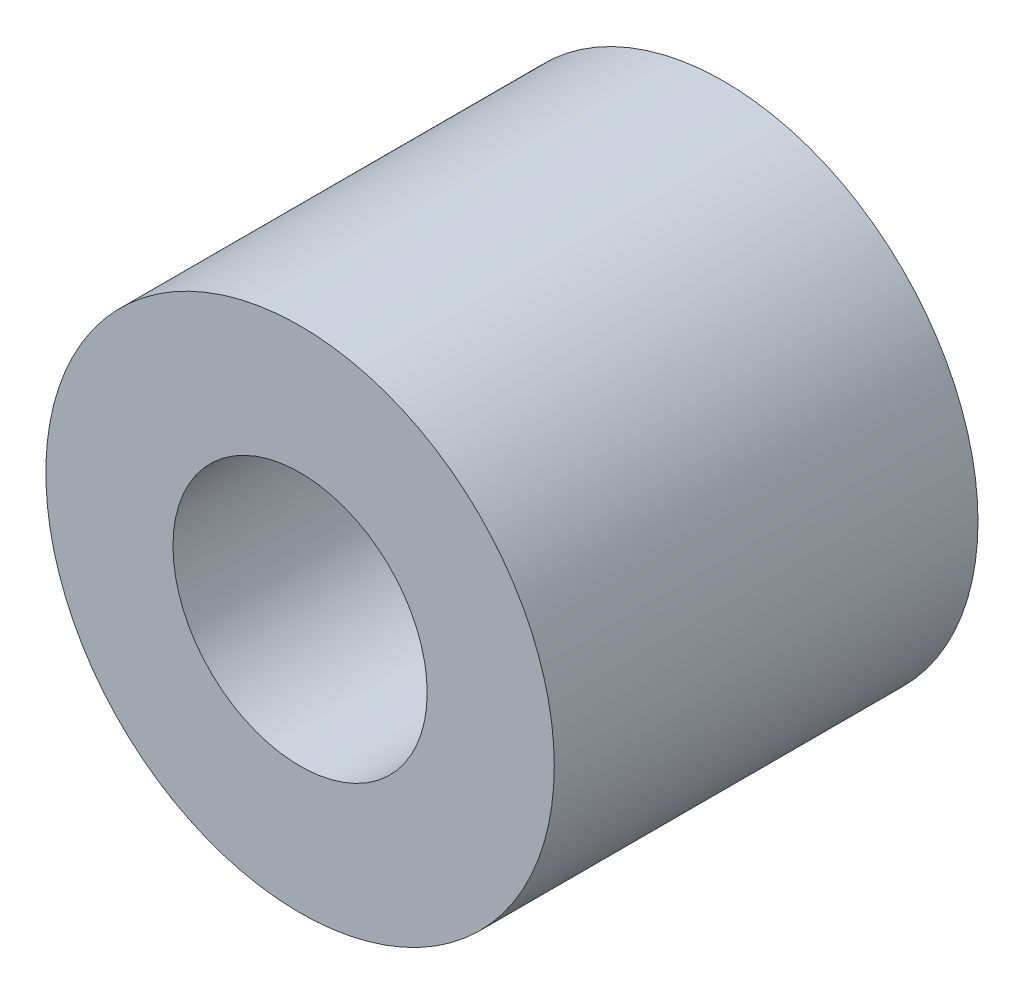
from build123d import *

# Parameters (mm, degrees)
SKETCH_1_R      = 3
SKETCH_1_R_2    = 1.5
EXTRUDE_1_DEPTH = 5


with BuildPart() as part:
    # ｽｹｯﾁ1 → ﾎﾞｽ - 押し出し1 (new body)
    with BuildSketch(Plane.XY):
        Circle(SKETCH_1_R)
        Circle(SKETCH_1_R_2, mode=Mode.SUBTRACT)
    extrude(amount=EXTRUDE_1_DEPTH)


solid = part.part
